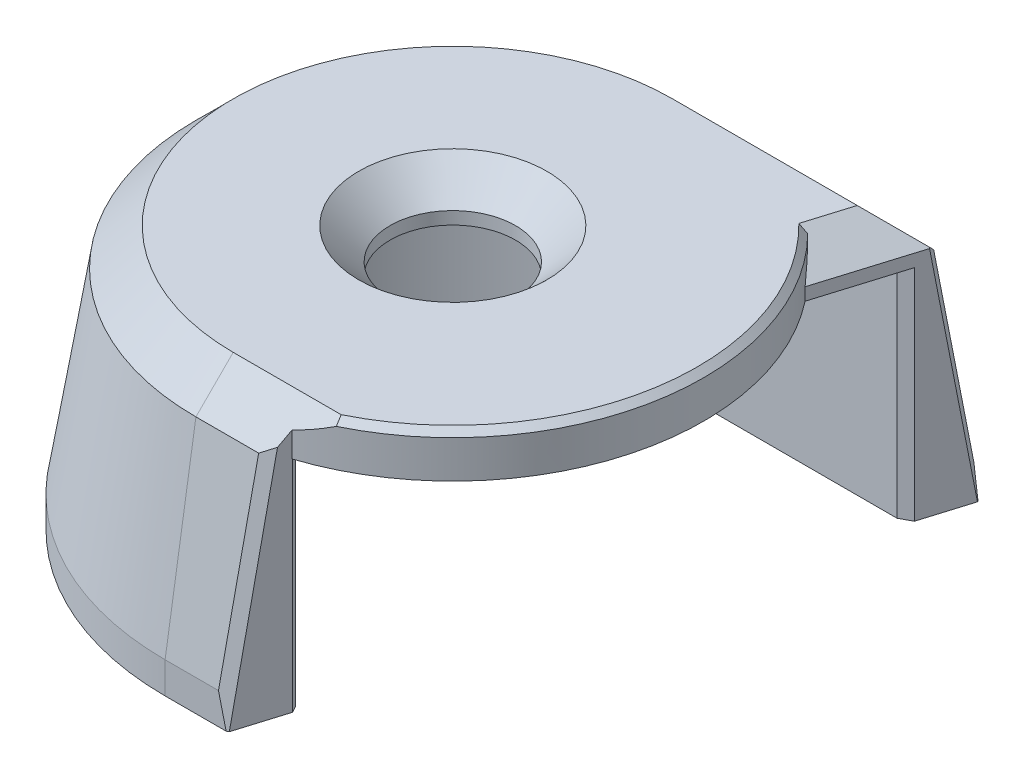
from build123d import *
from OCP.BRepFilletAPI import BRepFilletAPI_MakeChamfer

# Parameters (mm, degrees)
REVOLVE1_ANGLE          = 180
BOSS_EXTRUDE1_DEPTH     = 60
CUT_EXTRUDE2_DEPTH      = 87.407305825
CUT_EXTRUDE2_DEPTH_BACK = 87.407305825
SKETCH8_R               = 10
BOSS_EXTRUDE2_DEPTH     = 7
CHAMFER1_SIZE           = 5
CHAMFER1_SIZE2          = 6.012778745
CHAMFER2_SIZE           = 1
CHAMFER2_SIZE2          = 0.800998829
CHAMFER2_SIZE2_2        = 1.505173624
CHAMFER2_SIZE2_3        = 0.802603699
CHAMFER2_SIZE2_4        = 1.49466769


with BuildPart() as part:
    # Sketch2 → Revolve1 (revolve)
    with BuildSketch(Plane(origin=(0, 0, 0), x_dir=(0, 0, -1), z_dir=(1, 0, 0))):
        Polygon((37, 0), (45.85, 0), (45.85, 5), (40, 42), (0, 42), (0, 35), (37, 35), align=None)
    revolve(axis=Axis((0, 0, 0), (0, 1, 0)), revolution_arc=REVOLVE1_ANGLE)

    # Sketch7 → Boss-Extrude1 (add)
    with BuildSketch(Plane(origin=(0, 0, 0), x_dir=(0, 0, -1), z_dir=(1, 0, 0))):
        Polygon((-37, 0), (-37, 35), (37, 35), (37, 0), (45.85, 0), (45.85, 5), (40, 42), (-40, 42), (-45.85, 5), (-45.85, 0), align=None)
    extrude(amount=BOSS_EXTRUDE1_DEPTH)

    # Sketch8 → Cut-Extrude2 (cut, two sides: drawn at the far end of the back side and taken through both)
    with BuildSketch(Plane(origin=(0, 0, 0), x_dir=(1, 0, 0), z_dir=(0, 1, 0)).offset(-CUT_EXTRUDE2_DEPTH_BACK)):
        with Locations(Location((0, 0, 0), (0, 0, 270))):
            Circle(SKETCH8_R)
        Polygon((10, -45.85), (38, 45.85), (138, 45.85), (138, -45.85), align=None)
    extrude(amount=CUT_EXTRUDE2_DEPTH + CUT_EXTRUDE2_DEPTH_BACK, mode=Mode.SUBTRACT)

    # Sketch9 → Boss-Extrude2 (add)
    with BuildSketch(Plane(origin=(0, 42, 0), x_dir=(1, 0, 0), z_dir=(0, 1, 0))):
        with BuildLine():
            Line((31.519782555, 24.627287867), (0, -40))
            ThreePointArc((0, -40), (35.951992397, -17.534373175), (31.519782555, 24.627287867))
        make_face()
    extrude(amount=-BOSS_EXTRUDE2_DEPTH)

    # Chamfer1: one chamfer whose edges measure the first distance from different faces: ONE call of the kernel's chamfer builder (chamfer() names one face for all edges)
    chamfer1_edges_1 = [part.edges().sort_by_distance(p)[0] for p in [
        (-40, 42, 0),
        (5.893129771, 42, 40),
        (18.106870229, 42, -40),
    ]]
    chamfer1_side_1 = [part.faces().sort_by_distance(p)[0] for p in [
        (18.106870229, 42, -38.86862915),
    ]]
    chamfer1_edges_2 = [part.edges().sort_by_distance(p)[0] for p in [
        (0, 42, -10),
        (33.866761506, 42, -32.313643934),
    ]]
    chamfer1 = BRepFilletAPI_MakeChamfer(part.part.solid().wrapped)
    for e in chamfer1_edges_1:
        chamfer1.Add(CHAMFER1_SIZE, CHAMFER1_SIZE2, e.wrapped, chamfer1_side_1[0].wrapped)  # the first distance lies on this face
    for e in chamfer1_edges_2:
        chamfer1.Add(CHAMFER1_SIZE, e.wrapped)
    add(Compound.cast(chamfer1.Shape()), mode=Mode.REPLACE)

    # Chamfer2: one chamfer whose edges measure the first distance from different faces: ONE call of the kernel's chamfer builder (chamfer() names one face for all edges)
    chamfer2_edges_1 = [part.edges().sort_by_distance(p)[0] for p in [
        (39.67158228, 42, 5.115228187),
    ]]
    chamfer2_edges_2 = [part.edges().sort_by_distance(p)[0] for p in [
        (12.702290076, 17.5, 37),
    ]]
    chamfer2_side_2 = [part.faces().sort_by_distance(p)[0] for p in [
        (11.622460622, 15.898187568, 40.536441463),
    ]]
    chamfer2_edges_3 = [part.edges().sort_by_distance(p)[0] for p in [
        (35.297709924, 17.5, -37),
    ]]
    chamfer2_side_3 = [part.faces().sort_by_distance(p)[0] for p in [
        (36.103314257, 17.732760886, -39.638354191),
    ]]
    chamfer2_edges_4 = [part.edges().sort_by_distance(p)[0] for p in [
        (37.250229743, 20.530497592, -43.394502408),
    ]]
    chamfer2_side_4 = [part.faces().sort_by_distance(p)[0] for p in [
        (36.103314257, 17.732760886, -39.638354191),
    ]]
    chamfer2_edges_5 = [part.edges().sort_by_distance(p)[0] for p in [
        (10.749770257, 20.530497592, 43.394502408),
    ]]
    chamfer2_side_5 = [part.faces().sort_by_distance(p)[0] for p in [
        (11.622460622, 15.898187568, 40.536441463),
    ]]
    chamfer2 = BRepFilletAPI_MakeChamfer(part.part.solid().wrapped)
    for e in chamfer2_edges_1:
        chamfer2.Add(CHAMFER2_SIZE, e.wrapped)
    for e in chamfer2_edges_2:
        chamfer2.Add(CHAMFER2_SIZE, CHAMFER2_SIZE2, e.wrapped, chamfer2_side_2[0].wrapped)  # the first distance lies on this face
    for e in chamfer2_edges_3:
        chamfer2.Add(CHAMFER2_SIZE, CHAMFER2_SIZE2_2, e.wrapped, chamfer2_side_3[0].wrapped)  # the first distance lies on this face
    for e in chamfer2_edges_4:
        chamfer2.Add(CHAMFER2_SIZE, CHAMFER2_SIZE2_3, e.wrapped, chamfer2_side_4[0].wrapped)  # the first distance lies on this face
    for e in chamfer2_edges_5:
        chamfer2.Add(CHAMFER2_SIZE, CHAMFER2_SIZE2_4, e.wrapped, chamfer2_side_5[0].wrapped)  # the first distance lies on this face
    add(Compound.cast(chamfer2.Shape()), mode=Mode.REPLACE)


solid = part.part
